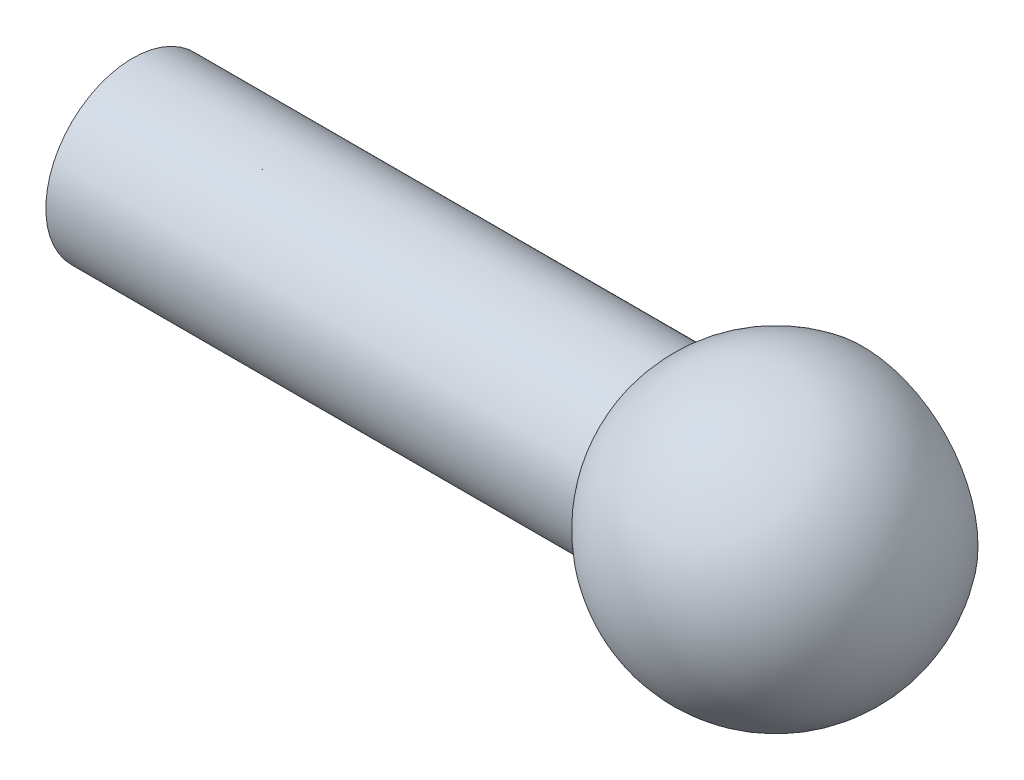
from build123d import *

# Parameters (mm, degrees)
SCHIZZO2_R                    = 2.05
ESTRUSIONE_ESTRUSIONE1_DEPTH  = 13
SCHIZZO3_R                    = 0.925
TAGLIO_ESTRUSIONE1_DEPTH      = 12
TAGLIO_ESTRUSIONE2_REACH      = 21.682
TAGLIO_ESTRUSIONE2_END_RADIUS = 1.975
SCHIZZO5_R                    = 1.825


with BuildPart() as part:
    # Schizzo2 → Estrusione-Estrusione1 (new body)
    with BuildSketch(Plane(origin=(0, 0, 0), x_dir=(0, 0, -1), z_dir=(1, 0, 0))):
        with Locations(Location((0, 0, 0), (0, 0, 180))):
            Circle(SCHIZZO2_R)
    extrude(amount=ESTRUSIONE_ESTRUSIONE1_DEPTH)

    # Schizzo3 → Taglio-Estrusione1 (cut)
    with BuildSketch(Plane.ZY):
        Circle(SCHIZZO3_R)
    extrude(amount=-TAGLIO_ESTRUSIONE1_DEPTH, mode=Mode.SUBTRACT)

    # Schizzo4 → Rivoluzione1 (revolve)
    with BuildSketch(Plane(origin=(0, 0, 0), x_dir=(1, 0, 0), z_dir=(0, 1, 0))):
        with BuildLine():
            Line((15.19, 3.41), (15.19, 1.975))
            ThreePointArc((15.19, 1.975), (17.165, 0), (15.19, -1.975))
            Line((15.19, -1.975), (15.19, -3.41))
            ThreePointArc((15.19, -3.41), (18.6, 0), (15.19, 3.41))
        make_face()
    revolve(axis=Axis((15.19, 0, 1.975), (0, 0, 1)))

    # TaglioSuperficie1
    split(bisect_by=Plane(origin=(0, 0, -2.05), x_dir=(-1, 0, 0), z_dir=(0, 0, -1)), keep=Keep.BOTTOM)

    # Taglio-Estrusione2: up to this sphere (the profile starts outside it)
    taglio_estrusione2_end = Location((15.19, 0, 0)) * Sphere(TAGLIO_ESTRUSIONE2_END_RADIUS, mode=Mode.PRIVATE)
    # Schizzo5 → Taglio-Estrusione2 (cut, up to the surface)
    with BuildSketch(Plane(origin=(0, 0, -2.05), x_dir=(-1, 0, 0), z_dir=(0, 0, -1)), mode=Mode.PRIVATE) as taglio_estrusione2_sk1:
        with Locations((-15.19, 0)):
            Circle(SCHIZZO5_R)
    taglio_estrusione2_tool1 = extrude(taglio_estrusione2_sk1.sketch, amount=-TAGLIO_ESTRUSIONE2_REACH, mode=Mode.PRIVATE) - taglio_estrusione2_end
    add(taglio_estrusione2_tool1.solids().sort_by_distance((15.19, 0, -2.05))[0], mode=Mode.SUBTRACT)


solid = part.part
